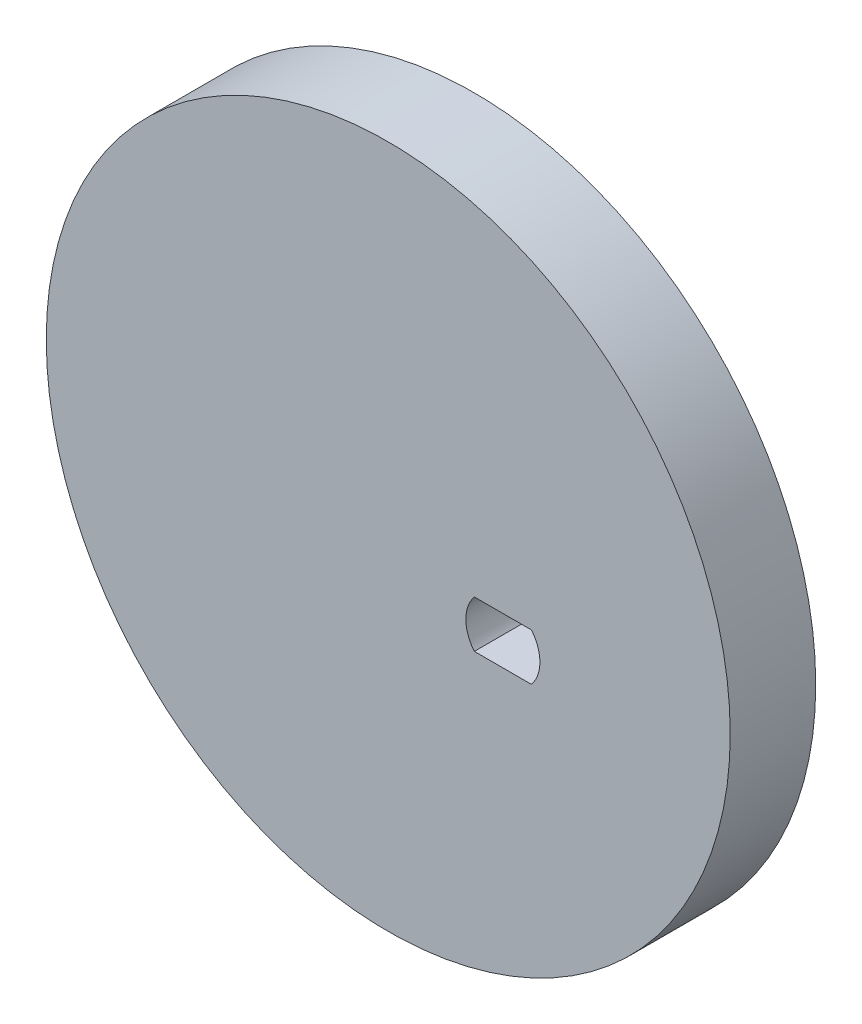
from build123d import *

# Parameters (mm, degrees)
SKETCH1_R           = 25.4
BOSS_EXTRUDE1_DEPTH = 6.35


with BuildPart() as part:
    # Sketch1 → Boss-Extrude1 (new body)
    with BuildSketch(Plane.XY):
        with Locations((-8.514653882, 2.430473335)):
            Circle(SKETCH1_R)
        with BuildLine():
            Line((-2.121320344, 1.75), (2.121320344, 1.75))
            ThreePointArc((2.121320344, 1.75), (2.75, 0), (2.121320344, -1.75))
            Line((2.121320344, -1.75), (-2.121320344, -1.75))
            ThreePointArc((-2.121320344, -1.75), (-2.75, 0), (-2.121320344, 1.75))
        make_face(mode=Mode.SUBTRACT)
    extrude(amount=BOSS_EXTRUDE1_DEPTH)


solid = part.part
